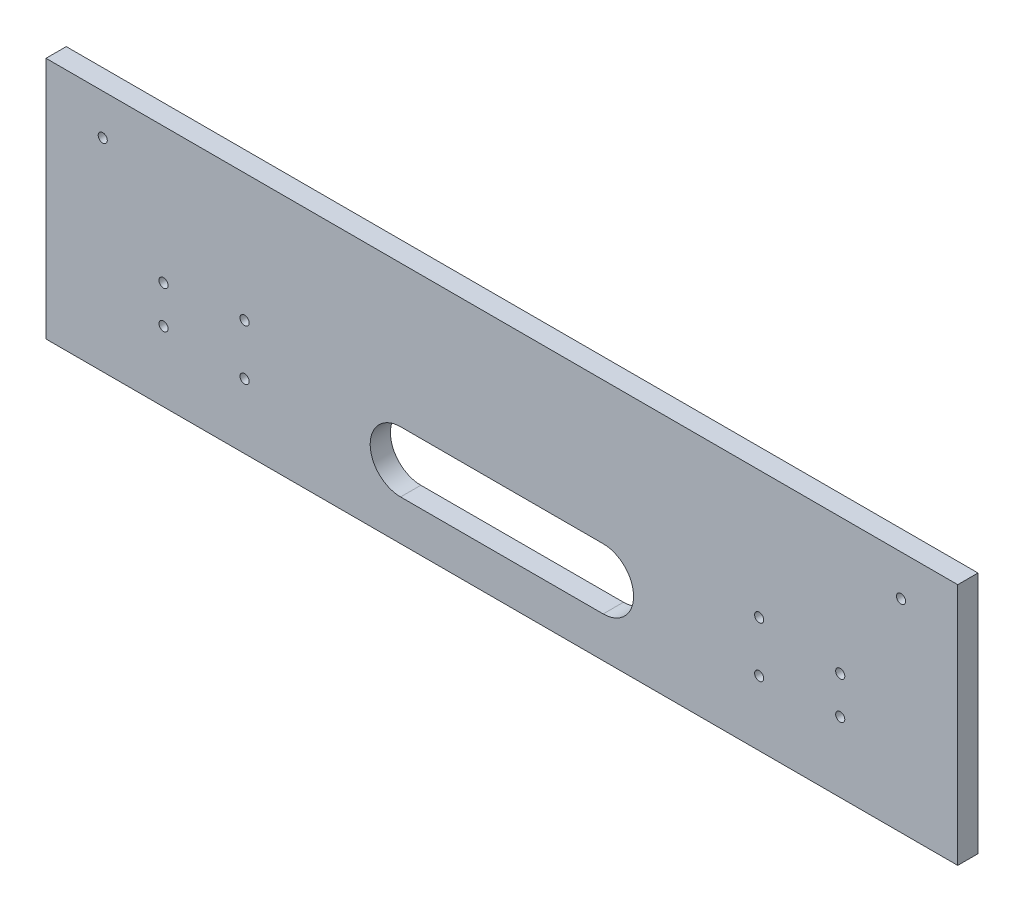
from build123d import *

# Parameters (mm, degrees)
SCHIZZO1_W                   = 450
SCHIZZO1_H                   = 120
ESTRUSIONE_ESTRUSIONE1_DEPTH = 10
TAGLIO_ESTRUSIONE1_DEPTH     = 10
SCHIZZO3_R                   = 2.25
TAGLIO_ESTRUSIONE2_DEPTH     = 10
SCHIZZO4_R                   = 2.25
TAGLIO_ESTRUSIONE3_DEPTH     = 10


with BuildPart() as part:
    # Schizzo1 → Estrusione-Estrusione1 (new body)
    with BuildSketch(Plane.XY):
        Rectangle(SCHIZZO1_W, SCHIZZO1_H)
    extrude(amount=ESTRUSIONE_ESTRUSIONE1_DEPTH)

    # Schizzo2 → Taglio-Estrusione1 (cut)
    with BuildSketch(Plane(origin=(0, 0, 0), x_dir=(-1, 0, 0), z_dir=(0, 0, -1))):
        with BuildLine():
            Line((-50, -10), (50, -10))
            ThreePointArc((50, -10), (65, -25), (50, -40))
            Line((50, -40), (-50, -40))
            ThreePointArc((-50, -40), (-65, -25), (-50, -10))
        make_face()
    extrude(amount=-TAGLIO_ESTRUSIONE1_DEPTH, mode=Mode.SUBTRACT)

    # Schizzo3 → Taglio-Estrusione2 (cut)
    with BuildSketch(Plane.XY.offset(10)):
        with Locations((-167, -7)):
            Circle(SCHIZZO3_R)
        with Locations((-167, -25.5)):
            Circle(SCHIZZO3_R)
        with Locations((167, -7)):
            Circle(SCHIZZO3_R)
        with Locations((167, -25.5)):
            Circle(SCHIZZO3_R)
        with Locations((197, 40)):
            Circle(SCHIZZO3_R)
        with Locations((-197, 40)):
            Circle(SCHIZZO3_R)
    extrude(amount=-TAGLIO_ESTRUSIONE2_DEPTH, mode=Mode.SUBTRACT)

    # Schizzo4 → Taglio-Estrusione3 (cut)
    with BuildSketch(Plane(origin=(0, 0, 0), x_dir=(-1, 0, 0), z_dir=(0, 0, -1))):
        with Locations((-127, -3)):
            Circle(SCHIZZO4_R)
        with Locations((-127, -28)):
            Circle(SCHIZZO4_R)
        with Locations((127, -28)):
            Circle(SCHIZZO4_R)
        with Locations((127, -3)):
            Circle(SCHIZZO4_R)
    extrude(amount=-TAGLIO_ESTRUSIONE3_DEPTH, mode=Mode.SUBTRACT)


solid = part.part
